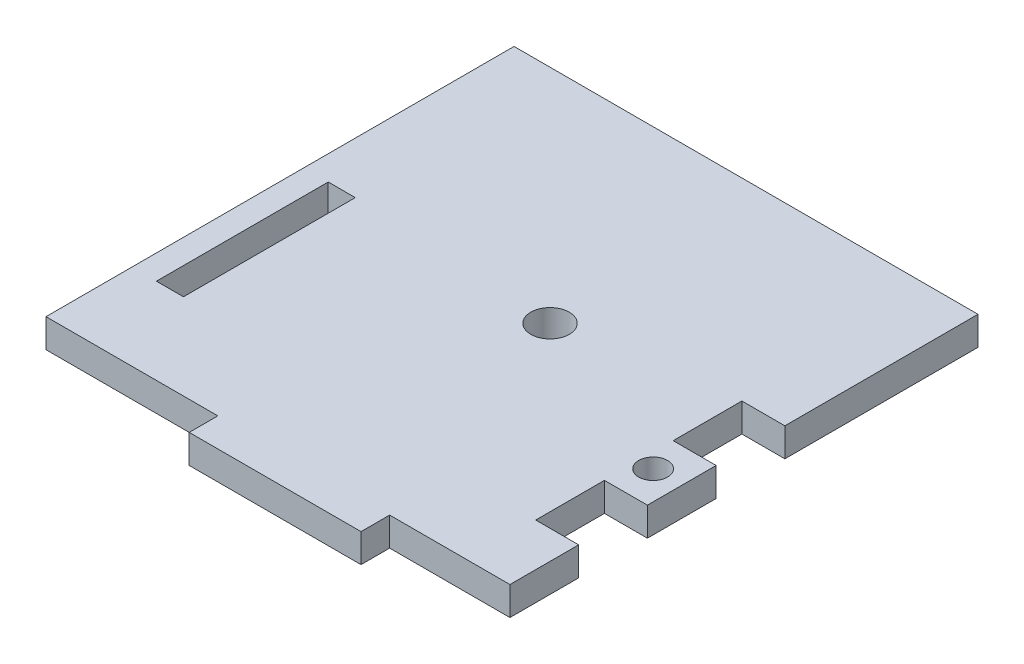
from build123d import *

# Parameters (mm, degrees)
BOSS_EXTRUDE1_DEPTH  = 3.175
M3_CLEARANCE_HOLE1_D = 3.2
SKETCH4_R            = 2.1336
CUT_EXTRUDE1_DEPTH   = 74.133031325
SKETCH5_W            = 3
SKETCH5_H            = 19.05
CUT_EXTRUDE2_DEPTH   = 74.133031325


with BuildPart() as part:
    # Sketch1 → Boss-Extrude1 (new body)
    with BuildSketch(Plane(origin=(0, 0, 0), x_dir=(1, 0, 0), z_dir=(0, 1, 0))):
        Polygon((0, 0), (19.05, 0), (19.05, -3.175), (38.1, -3.175), (38.1, 0), (51.435, 0), (51.435, 7.62), (46.6725, 7.62), (46.6725, 15.24), (51.435, 15.24), (51.435, 22.86), (46.6725, 22.86), (46.6725, 30.48), (51.435, 30.48), (51.435, 51.8922), (0, 51.8922), align=None)
    extrude(amount=BOSS_EXTRUDE1_DEPTH)

    # M3 Clearance Hole1 (through all)
    with Locations(Plane(origin=(0, 3.175, 0), x_dir=(1, 0, 0), z_dir=(0, 1, 0))):
        with Locations((48.26, 19.05)):
            Hole(M3_CLEARANCE_HOLE1_D / 2)

    # Sketch4 → Cut-Extrude1 (cut, through all)
    with BuildSketch(Plane(origin=(0, 3.175, 0), x_dir=(1, 0, 0), z_dir=(0, 1, 0))):
        with Locations(Location((28.575, 27.305, 0), (0, 0, 270))):
            Circle(SKETCH4_R)
    extrude(amount=-CUT_EXTRUDE1_DEPTH, mode=Mode.SUBTRACT)

    # Sketch5 → Cut-Extrude2 (cut, through all)
    with BuildSketch(Plane(origin=(0, 3.175, 0), x_dir=(1, 0, 0), z_dir=(0, 1, 0))):
        with Locations((4.215, 19.05)):
            Rectangle(SKETCH5_W, SKETCH5_H)
    extrude(amount=-CUT_EXTRUDE2_DEPTH, mode=Mode.SUBTRACT)


solid = part.part
